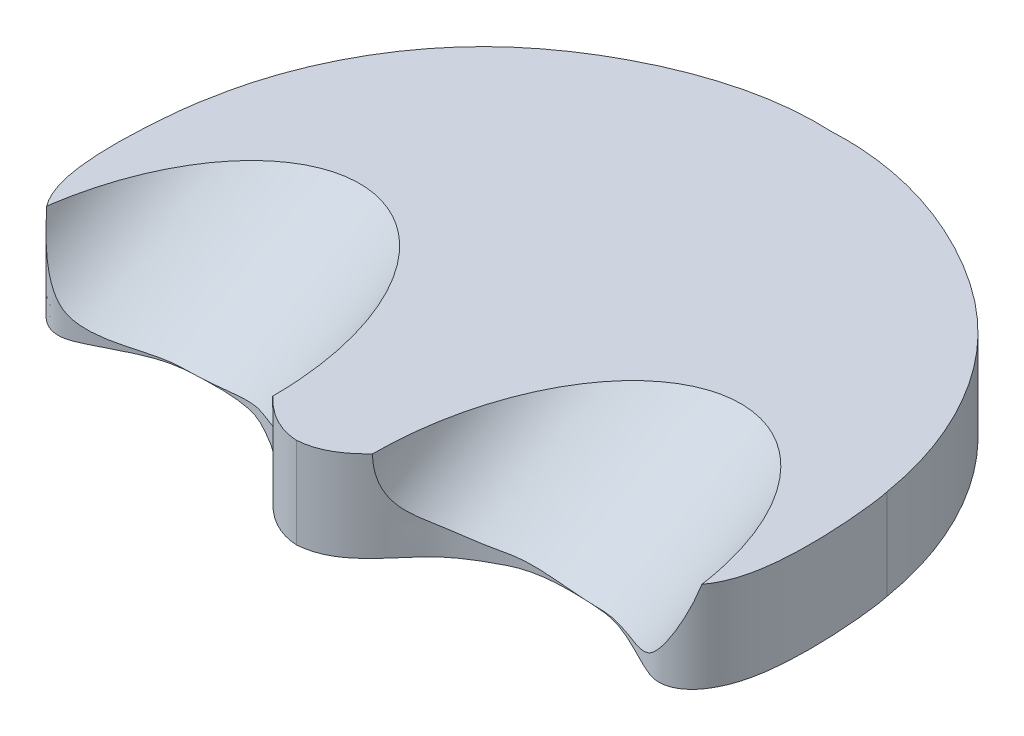
from build123d import *

# Parameters (mm, degrees)
BOSS_EXTRUDE1_DEPTH     = 50.8
CUT_EXTRUDE1_DEPTH      = 260.287236955
CUT_EXTRUDE1_DEPTH_BACK = 260.287236955
SKETCH6_RX              = 78.834045808
SKETCH6_RY              = 63.772521642


with BuildPart() as part:
    # Sketch3 → Boss-Extrude1 (new body)
    with BuildSketch(Plane(origin=(0, 0, 0), x_dir=(1, 0, 0), z_dir=(0, 1, 0))):
        with BuildLine():
            add(Edge.make_bspline(
                [(-190.5, 0), (-184.392726562, 37.537038237), (-157.261289847, 93.964093485), (-82.387478202, 146.622658841), (-31.311374143, 160.799884185), (0, 159.189909928)],
                knots=[0, 0, 0, 0, 0.424401366, 0.656369581, 1, 1, 1, 1], degree=3))
            add(Edge.make_bspline(
                [(190.5, 0), (184.392726562, 37.537038237), (157.261289847, 93.964093485), (82.387478202, 146.622658841), (31.311374143, 160.799884185), (0, 159.189909928)],
                knots=[0, 0, 0, 0, 0.424401366, 0.656369581, 1, 1, 1, 1], degree=3))
            add(Edge.make_bspline(
                [(190.5, 0), (192.064011793, -4.963501926), (201.967167766, -83.314618311), (174.696602041, -109.289958804), (151.630121659, -100.567984898), (131.410771519, -87.719783961), (96.843567628, -85.375403377), (78.692510144, -86.25882742), (58.833533072, -96.87938247), (37.30593461, -109.935798162), (21.349613946, -139.114767457), (0, -140.530090072)],
                knots=[0, 0, 0, 0, 0.166997052, 0.292320514, 0.319633117, 0.42673531, 0.45891405, 0.609241775, 0.641909704, 0.76680237, 1, 1, 1, 1], degree=3))
            add(Edge.make_bspline(
                [(-190.5, 0), (-192.064011793, -4.963501926), (-201.967167766, -83.314618311), (-174.696602041, -109.289958804), (-151.630121659, -100.567984898), (-131.410771519, -87.719783961), (-96.843567628, -85.375403377), (-78.692510144, -86.25882742), (-58.833533072, -96.87938247), (-37.30593461, -109.935798162), (-21.349613946, -139.114767457), (0, -140.530090072)],
                knots=[0, 0, 0, 0, 0.166997052, 0.292320514, 0.319633117, 0.42673531, 0.45891405, 0.609241775, 0.641909704, 0.76680237, 1, 1, 1, 1], degree=3))
        make_face()
    extrude(amount=BOSS_EXTRUDE1_DEPTH)

    # Sketch6 → Cut-Extrude1 (cut, two sides: drawn at the far end of the back side and taken through both)
    with BuildSketch(Plane(origin=(0, 24.086508497, 9.976958489), x_dir=(-1, 0, 0), z_dir=(0, 0.5000000000000041, -0.8660254037844364)).offset(-CUT_EXTRUDE1_DEPTH_BACK)):
        with Locations(Location((-106.808169671, 81.026464977), (0, 0, -180))):
            Ellipse(SKETCH6_RX, SKETCH6_RY)
        with Locations(Location((106.808169671, 81.026464977), (0, 0, 180))):
            Ellipse(SKETCH6_RX, SKETCH6_RY)
    extrude(amount=CUT_EXTRUDE1_DEPTH + CUT_EXTRUDE1_DEPTH_BACK, mode=Mode.SUBTRACT)


solid = part.part
